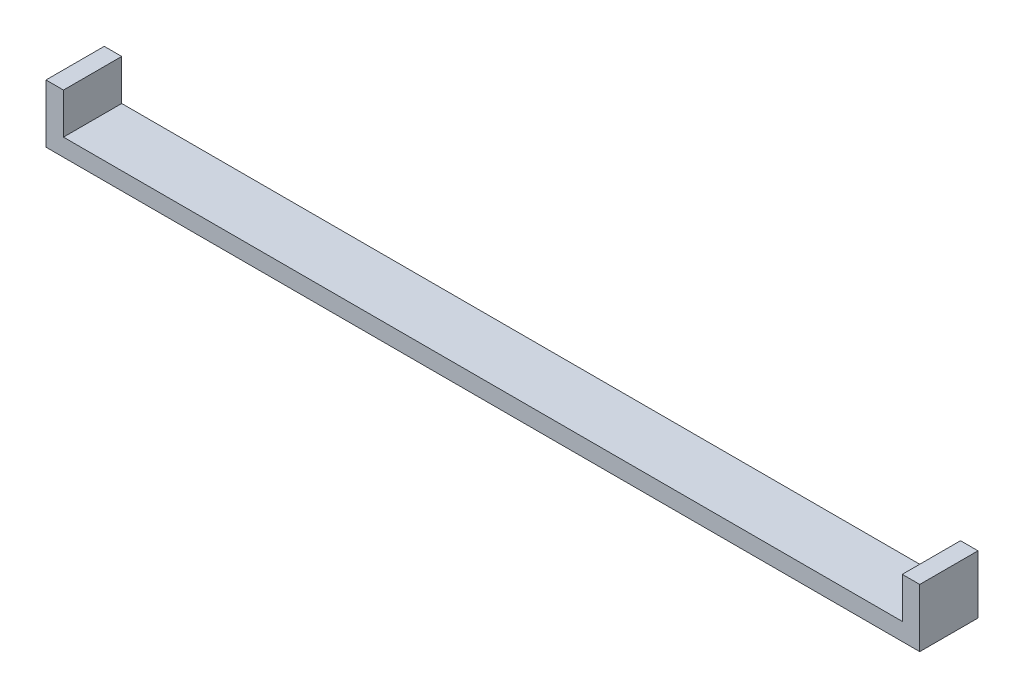
from build123d import *

# Parameters (mm, degrees)
BOSS_EXTRUDE1_DEPTH = 10


with BuildPart() as part:
    # Sketch1 → Boss-Extrude1 (new body)
    with BuildSketch(Plane.XY):
        Polygon((-74.353448276, -37.931034483), (75.646551724, -37.931034483), (75.646551724, -27.931034483), (72.646551724, -27.931034483), (72.646551724, -34.931034483), (-71.353448276, -34.931034483), (-71.353448276, -27.931034483), (-74.353448276, -27.931034483), align=None)
    extrude(amount=BOSS_EXTRUDE1_DEPTH)


solid = part.part
